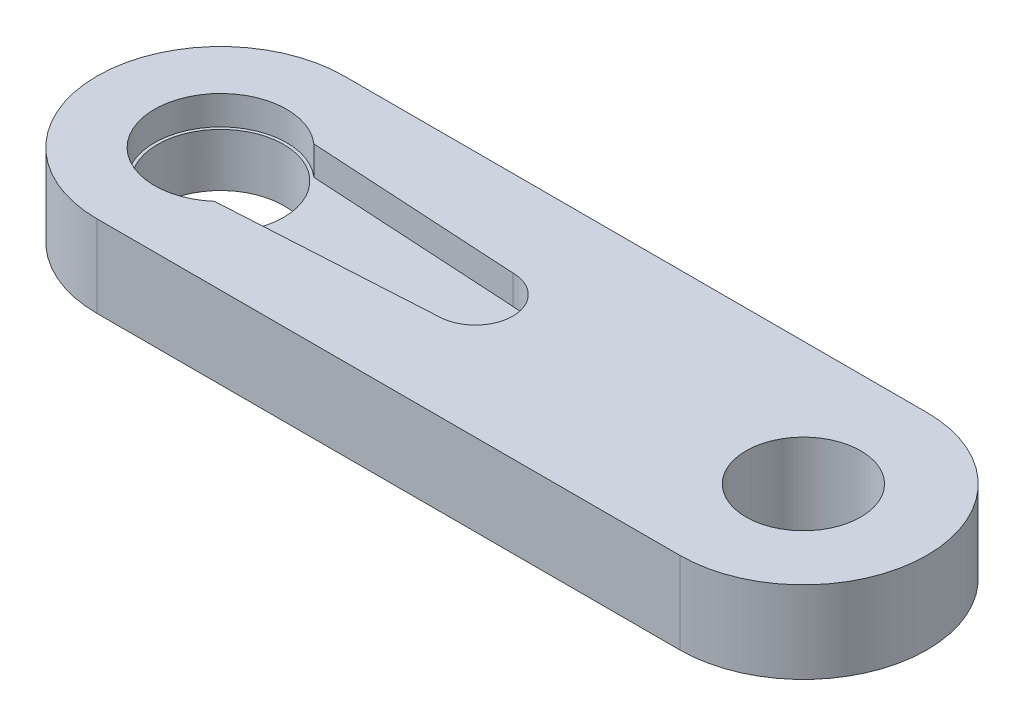
from build123d import *

# Parameters (mm, degrees)
BOSS_EXTRUDE1_DEPTH = 3
SKETCH2_R           = 3.575
CUT_EXTRUDE1_DEPTH  = 3.95
BOSS_EXTRUDE2_DEPTH = 1.64
SKETCH4_R           = 3.25
CUT_EXTRUDE2_DEPTH  = 4.64


with BuildPart() as part:
    # Sketch1 → Boss-Extrude1 (new body)
    with BuildSketch(Plane(origin=(0, 0, 0), x_dir=(1, 0, 0), z_dir=(0, 1, 0))):
        with BuildLine():
            Line((0, 7), (33, 7))
            ThreePointArc((33, 7), (40, 0), (33, -7))
            Line((33, -7), (0, -7))
            ThreePointArc((0, -7), (-7, 0), (0, 7))
        make_face()
    extrude(amount=BOSS_EXTRUDE1_DEPTH)

    # Sketch2 → Cut-Extrude1 (cut)
    with BuildSketch(Plane.XZ):
        with Locations(Location((0, 0, 0), (0, 0, 270))):
            Circle(SKETCH2_R)
    extrude(amount=-CUT_EXTRUDE1_DEPTH, mode=Mode.SUBTRACT)

    # Sketch3 → Boss-Extrude2 (add)
    with BuildSketch(Plane(origin=(0, 3, 0), x_dir=(1, 0, 0), z_dir=(0, 1, 0))):
        with BuildLine():
            Line((0, -7), (33, -7))
            ThreePointArc((33, -7), (40, 0), (33, 7))
            Line((33, 7), (0, 7))
            ThreePointArc((0, 7), (-7, 0), (0, -7))
        make_face()
        with BuildLine():
            Line((14.43004688, 2.119993993), (2.468524523, 2.816276208))
            ThreePointArc((2.468524523, 2.816276208), (-3.745, 0), (2.468524523, -2.816276208))
            Line((2.468524523, -2.816276208), (14.43004688, -2.119993993))
            ThreePointArc((14.43004688, -2.119993993), (16.545, 0), (14.43004688, 2.119993993))
        make_face(mode=Mode.SUBTRACT)
    extrude(amount=BOSS_EXTRUDE2_DEPTH)

    # Sketch4 → Cut-Extrude2 (cut)
    with BuildSketch(Plane(origin=(0, 4.64, 0), x_dir=(1, 0, 0), z_dir=(0, 1, 0))):
        with Locations(Location((33, 0, 0), (0, 0, 270))):
            Circle(SKETCH4_R)
    extrude(amount=-CUT_EXTRUDE2_DEPTH, mode=Mode.SUBTRACT)


solid = part.part
